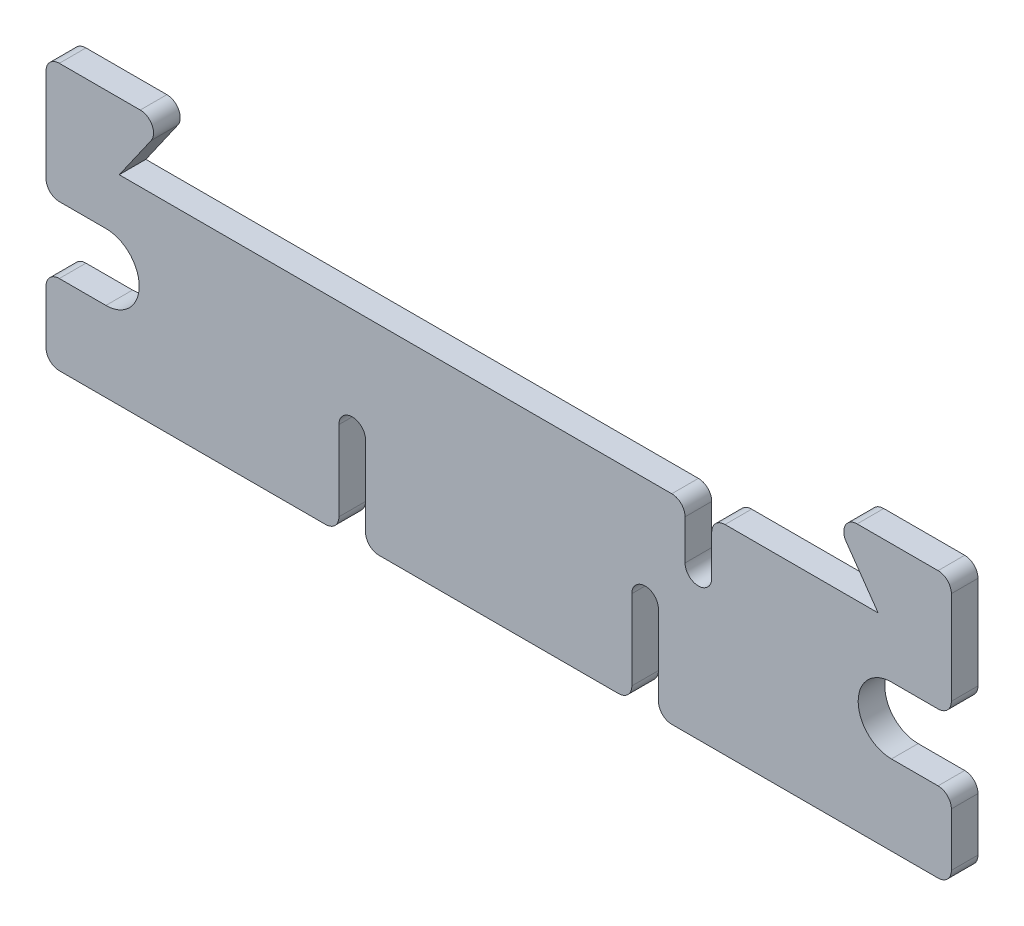
from build123d import *

# Parameters (mm, degrees)
RESSALTO_EXTRUS_O1_DEPTH = 2


with BuildPart() as part:
    # Esboço1 → Ressalto-extrusão1 (new body)
    with BuildSketch(Plane.XY):
        with BuildLine():
            Line((-28.5, 0), (13, 0))
            ThreePointArc((13, 0), (13.707106781, -0.292893219), (14, -1))
            Line((14, -1), (14, -4))
            ThreePointArc((14, -4), (15, -5), (16, -4))
            Line((16, -4), (16, -1))
            ThreePointArc((16, -1), (16.292893219, -0.292893219), (17, 0))
            Line((17, 0), (28.5, 0))
            Line((28.5, 0), (26.101423641, 3.426537656))
            ThreePointArc((26.101423641, 3.426537656), (26.033676885, 4.461810381), (26.920655562, 5))
            Line((26.920655562, 5), (33, 5))
            ThreePointArc((33, 5), (33.707106781, 4.707106781), (34, 4))
            Line((34, 4), (34, -3))
            ThreePointArc((34, -3), (33.707106781, -3.707106781), (33, -4))
            Line((33, -4), (29.5, -4))
            ThreePointArc((29.5, -4), (27, -6.5), (29.5, -9))
            Line((29.5, -9), (33, -9))
            ThreePointArc((33, -9), (33.707106781, -9.292893219), (34, -10))
            Line((34, -10), (34, -14))
            ThreePointArc((34, -14), (33.707106781, -14.707106781), (33, -15))
            Line((33, -15), (13, -15))
            ThreePointArc((13, -15), (12.292893219, -14.707106781), (12, -14))
            Line((12, -14), (12, -8))
            ThreePointArc((12, -8), (11, -7), (10, -8))
            Line((10, -8), (10, -14))
            ThreePointArc((10, -14), (9.707106781, -14.707106781), (9, -15))
            Line((9, -15), (-9, -15))
            ThreePointArc((-9, -15), (-9.707106781, -14.707106781), (-10, -14))
            Line((-10, -14), (-10, -8))
            ThreePointArc((-10, -8), (-11, -7), (-12, -8))
            Line((-12, -8), (-12, -14))
            ThreePointArc((-12, -14), (-12.292893219, -14.707106781), (-13, -15))
            Line((-13, -15), (-33, -15))
            ThreePointArc((-33, -15), (-33.707106781, -14.707106781), (-34, -14))
            Line((-34, -14), (-34, -10))
            ThreePointArc((-34, -10), (-33.707106781, -9.292893219), (-33, -9))
            Line((-33, -9), (-29.5, -9))
            ThreePointArc((-29.5, -9), (-27, -6.5), (-29.5, -4))
            Line((-29.5, -4), (-33, -4))
            ThreePointArc((-33, -4), (-33.707106781, -3.707106781), (-34, -3))
            Line((-34, -3), (-34, 4))
            ThreePointArc((-34, 4), (-33.707106781, 4.707106781), (-33, 5))
            Line((-33, 5), (-26.920655562, 5))
            ThreePointArc((-26.920655562, 5), (-26.033676885, 4.461810381), (-26.101423641, 3.426537656))
            Line((-26.101423641, 3.426537656), (-28.5, 0))
        make_face()
    extrude(amount=RESSALTO_EXTRUS_O1_DEPTH)


solid = part.part
